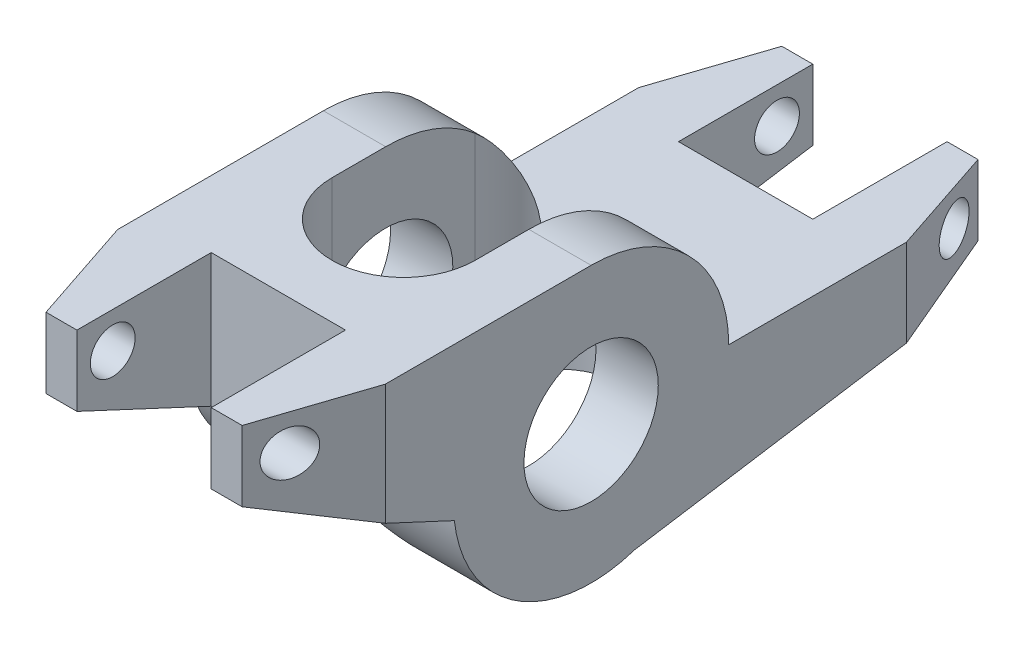
from build123d import *
from OCP.BRepFilletAPI import BRepFilletAPI_MakeChamfer

# Parameters (mm, degrees)
SKETCH1_R           = 4.765
BOSS_EXTRUDE1_DEPTH = 9.5
CHAMFER1_SIZE       = 2.54
CHAMFER1_SIZE2      = 7.62
CHAMFER2_SIZE       = 7.62
CHAMFER2_SIZE2      = 2.54
CUT_EXTRUDE1_DEPTH  = 24.5
SKETCH3_W           = 9.53
SKETCH3_H           = 9.53
CUT_EXTRUDE2_DEPTH  = 24.5
SKETCH4_R           = 1.59
CUT_EXTRUDE3_DEPTH  = 24.5


with BuildPart() as part:
    # Sketch1 → Boss-Extrude1 (new, symmetric)
    with BuildSketch(Plane(origin=(0, 0, 0), x_dir=(0, 0, -1), z_dir=(1, 0, 0))):
        with BuildLine():
            Line((0, 9.765), (-22.225, 9.765))
            Line((-22.225, 9.765), (-22.225, 4.765))
            Line((-22.225, 4.765), (-9.705896356, -1.072753903))
            ThreePointArc((-9.705896356, -1.072753903), (-5.266309461, -8.223211639), (3.085595591, -9.264681584))
            Line((3.085595591, -9.264681584), (29.995, -5))
            Line((29.995, -5), (29.995, 0))
            Line((29.995, 0), (9.765, 0))
            ThreePointArc((9.765, 0), (6.904897718, 6.904897718), (0, 9.765))
        make_face()
        Circle(SKETCH1_R, mode=Mode.SUBTRACT)
    extrude(amount=BOSS_EXTRUDE1_DEPTH, both=True)

    # Chamfer1: one chamfer whose edges measure the first distance from different faces: ONE call of the kernel's chamfer builder (chamfer() names one face for all edges)
    chamfer1_edges_1 = [part.edges().sort_by_distance(p)[0] for p in [
        (9.5, 7.265, 22.225),
    ]]
    chamfer1_side_1 = [part.faces().sort_by_distance(p)[0] for p in [
        (0, 7.265, 22.225),
    ]]
    chamfer1_edges_2 = [part.edges().sort_by_distance(p)[0] for p in [
        (9.5, -2.5, -29.995),
    ]]
    chamfer1_side_2 = [part.faces().sort_by_distance(p)[0] for p in [
        (0, -2.5, -29.995),
    ]]
    chamfer1 = BRepFilletAPI_MakeChamfer(part.part.solid().wrapped)
    for e in chamfer1_edges_1:
        chamfer1.Add(CHAMFER1_SIZE, CHAMFER1_SIZE2, e.wrapped, chamfer1_side_1[0].wrapped)  # the first distance lies on this face
    for e in chamfer1_edges_2:
        chamfer1.Add(CHAMFER1_SIZE, CHAMFER1_SIZE2, e.wrapped, chamfer1_side_2[0].wrapped)  # the first distance lies on this face
    add(Compound.cast(chamfer1.Shape()), mode=Mode.REPLACE)

    # Chamfer2
    chamfer2_edges = [part.edges().sort_by_distance(p)[0] for p in [
        (-9.5, -2.5, -29.995),
        (-9.5, 7.265, 22.225),
    ]]
    chamfer2_side = [part.faces().sort_by_distance(p)[0] for p in [
        (-9.5, 9.207474279, 11.1125),
    ]]
    chamfer(chamfer2_edges, length=CHAMFER2_SIZE, length2=CHAMFER2_SIZE2, reference=chamfer2_side[0])

    # Sketch2 → Cut-Extrude1 (cut, symmetric)
    with BuildSketch(Plane(origin=(0, 0, 0), x_dir=(1, 0, 0), z_dir=(0, 1, 0))):
        with BuildLine():
            Line((-5.08, -3.81), (-5.08, 6.35))
            ThreePointArc((-5.08, 6.35), (0, 11.43), (5.08, 6.35))
            Line((5.08, 6.35), (5.08, -3.81))
            ThreePointArc((5.08, -3.81), (0, -8.89), (-5.08, -3.81))
        make_face()
    extrude(amount=CUT_EXTRUDE1_DEPTH, both=True, mode=Mode.SUBTRACT)

    # Sketch3 → Cut-Extrude2 (cut, symmetric)
    with BuildSketch(Plane(origin=(0, 0, 0), x_dir=(1, 0, 0), z_dir=(0, 1, 0))):
        with Locations((0, 25.23)):
            Rectangle(SKETCH3_W, SKETCH3_H)
        with Locations((0, -17.46)):
            Rectangle(SKETCH3_W, SKETCH3_H)
    extrude(amount=CUT_EXTRUDE2_DEPTH, both=True, mode=Mode.SUBTRACT)

    # Sketch4 → Cut-Extrude3 (cut, symmetric)
    with BuildSketch(Plane(origin=(0, 0, 0), x_dir=(0, 0, -1), z_dir=(1, 0, 0))):
        with Locations(Location((-19.685, 7.225, 0), (0, 0, 180))):
            Circle(SKETCH4_R)
        with Locations((27.455, -2.54)):
            Circle(SKETCH4_R)
    extrude(amount=CUT_EXTRUDE3_DEPTH, both=True, mode=Mode.SUBTRACT)


solid = part.part
